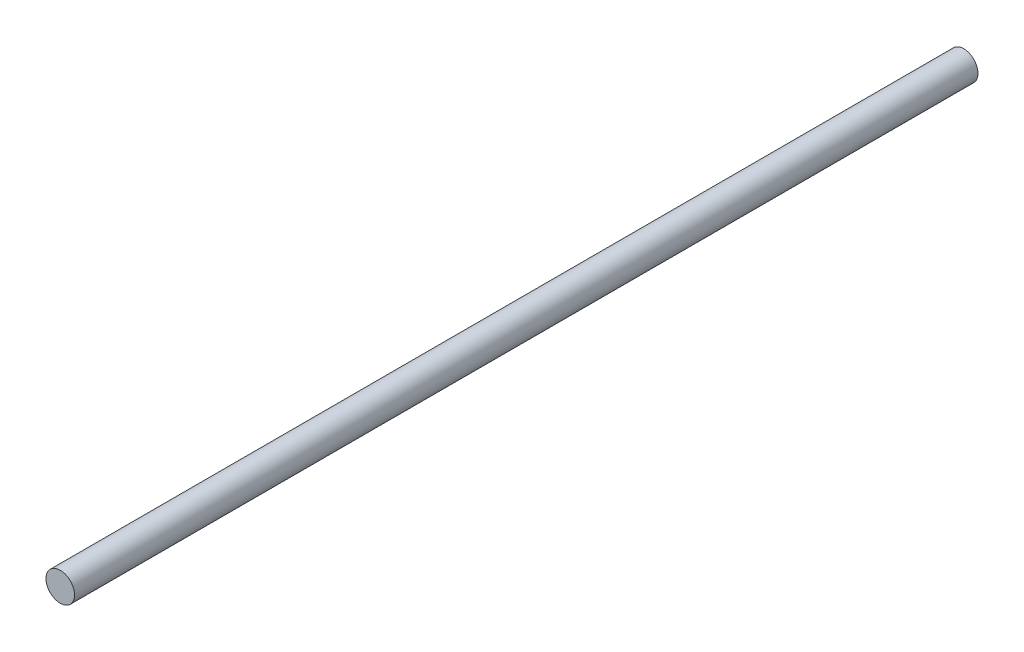
from build123d import *

# Parameters (mm, degrees)
SKETCH_1_R      = 2.5
EXTRUDE_1_DEPTH = 158


with BuildPart() as part:
    # Эскиз1 → Вытянуть1 (new body)
    with BuildSketch(Plane.XY):
        Circle(SKETCH_1_R)
    extrude(amount=EXTRUDE_1_DEPTH)


solid = part.part
